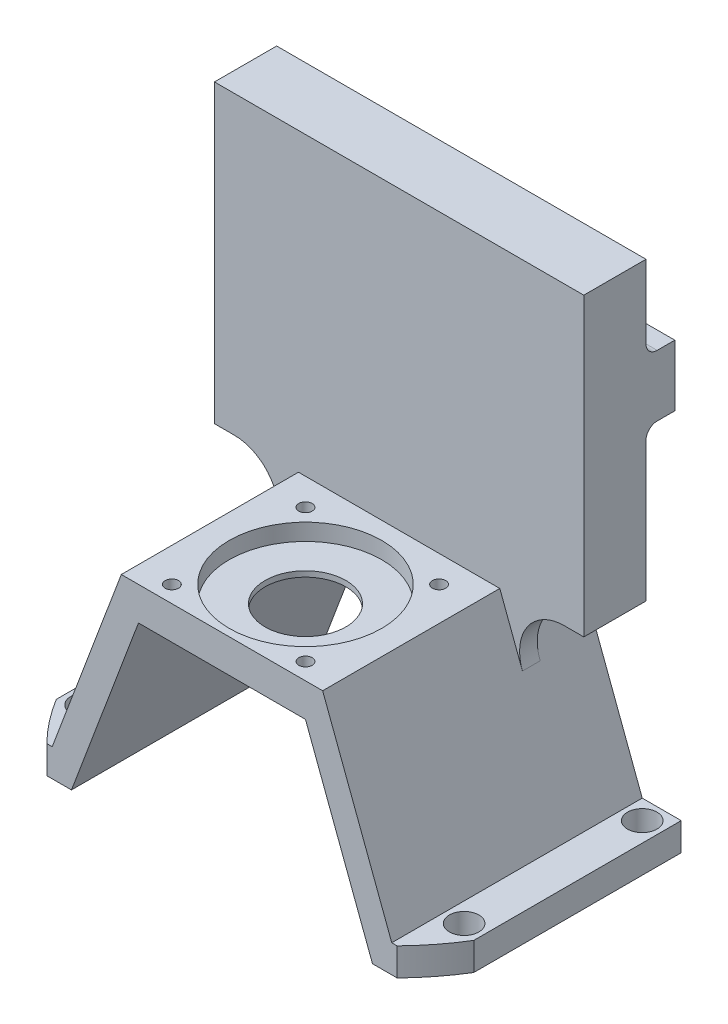
from build123d import *

# Parameters (mm, degrees)
BOSS_EXTRUDE1_DEPTH                             = 45
SKETCH3_R                                       = 13.7
CUT_EXTRUDE1_DEPTH                              = 3
CSK_FOR_M2_FLAT_HEAD_MACHINE_SCREW1_D           = 2.4
CSK_FOR_M2_FLAT_HEAD_MACHINE_SCREW1_CSINK_D     = 4.4
CSK_FOR_M2_FLAT_HEAD_MACHINE_SCREW1_CSINK_ANGLE = 90
SKETCH10_R                                      = 7.25
CUT_EXTRUDE2_DEPTH                              = 69.23672032
SKETCH15_R                                      = 48.495489481
SKETCH15_R_2                                    = 44
CUT_EXTRUDE4_DEPTH                              = 70.822990483
SKETCH11_R                                      = 10.5
CUT_EXTRUDE3_DEPTH                              = 2
CBORE_FOR_M5_HEX_HEAD_BOLT1_D                   = 3.4
CBORE_FOR_M5_HEX_HEAD_BOLT1_CBORE_D             = 5.3
CBORE_FOR_M5_HEX_HEAD_BOLT1_CBORE_DEPTH         = 4
SKETCH19_W                                      = 66.35
SKETCH19_H                                      = 3.175
BOSS_EXTRUDE5_DEPTH                             = 53.175
BOSS_EXTRUDE9_DEPTH                             = 8
FILLET2_R                                       = 8
FILLET3_R                                       = 8
SKETCH24_W                                      = 3.175
SKETCH24_H                                      = 11
BOSS_EXTRUDE10_DEPTH                            = 5.175
SKETCH25_W                                      = 3.175
SKETCH25_H                                      = 11
BOSS_EXTRUDE11_DEPTH                            = 60
FILLET4_R                                       = 2


with BuildPart() as part:
    # Sketch1 → Boss-Extrude1 (new body)
    with BuildSketch(Plane.XY):
        Polygon((-37.5, 0), (-27.038942926, 0), (-15, 32), (15, 32), (27.038942926, 0), (37.5, 0), (37.5, 5), (30.5, 5), (18.084840108, 38), (-18.084840108, 38), (-30.5, 5), (-37.5, 5), align=None)
    extrude(amount=BOSS_EXTRUDE1_DEPTH)

    # Sketch3 → Cut-Extrude1 (cut)
    with BuildSketch(Plane(origin=(0, 38, 0), x_dir=(1, 0, 0), z_dir=(0, 1, 0))):
        with Locations(Location((0, -30, 0), (0, 0, 180))):
            Circle(SKETCH3_R)
    extrude(amount=-CUT_EXTRUDE1_DEPTH, mode=Mode.SUBTRACT)

    # CSK for M2 Flat Head Machine Screw1 (through all)
    with Locations(Plane(origin=(0, 32, 0), x_dir=(-1, 0, 0), z_dir=(0, -1, 0))):
        with Locations((12, -42), (-12, -42), (-12, -18), (12, -18)):
            CounterSinkHole(CSK_FOR_M2_FLAT_HEAD_MACHINE_SCREW1_D / 2, CSK_FOR_M2_FLAT_HEAD_MACHINE_SCREW1_CSINK_D / 2, counter_sink_angle=CSK_FOR_M2_FLAT_HEAD_MACHINE_SCREW1_CSINK_ANGLE)

    # Sketch10 → Cut-Extrude2 (cut, through all)
    with BuildSketch(Plane(origin=(0, 35, 0), x_dir=(1, 0, 0), z_dir=(0, 1, 0))):
        with Locations(Location((0, -30, 0), (0, 0, 180))):
            Circle(SKETCH10_R)
    extrude(amount=-CUT_EXTRUDE2_DEPTH, mode=Mode.SUBTRACT)

    # Sketch15 → Cut-Extrude4 (cut, through all)
    with BuildSketch(Plane(origin=(0, 38, 0), x_dir=(1, 0, 0), z_dir=(0, 1, 0))):
        with Locations((0, -14.25)):
            Circle(SKETCH15_R)
        with Locations((0, -14.25)):
            Circle(SKETCH15_R_2, mode=Mode.SUBTRACT)
    extrude(amount=-CUT_EXTRUDE4_DEPTH, mode=Mode.SUBTRACT)

    # Sketch11 → Cut-Extrude3 (cut)
    with BuildSketch(Plane.XZ.offset(-32)):
        with Locations((0, 30)):
            Circle(SKETCH11_R)
    extrude(amount=-CUT_EXTRUDE3_DEPTH, mode=Mode.SUBTRACT)

    # CBORE for M5 Hex Head Bolt1 (through all)
    with Locations(Plane(origin=(0, 5, 0), x_dir=(-1, 0, 0), z_dir=(0, 1, 0))):
        with Locations((34, 35.5), (34, 3.5), (-34, 3.5), (-34, 35.5)):
            CounterBoreHole(CBORE_FOR_M5_HEX_HEAD_BOLT1_D / 2, CBORE_FOR_M5_HEX_HEAD_BOLT1_CBORE_D / 2, CBORE_FOR_M5_HEX_HEAD_BOLT1_CBORE_DEPTH)

    # Sketch19 → Boss-Extrude5 (add)
    with BuildSketch(Plane(origin=(0, 38, 0), x_dir=(1, 0, 0), z_dir=(0, 1, 0))):
        with Locations((0, -11.5875)):
            Rectangle(SKETCH19_W, SKETCH19_H)
    extrude(amount=BOSS_EXTRUDE5_DEPTH)

    # Sketch23 → Boss-Extrude9 (add)
    with BuildSketch(Plane(origin=(0, 0, 10), x_dir=(-1, 0, 0), z_dir=(0, 0, -1))):
        Polygon((-33.175, 38), (-30, 38), (-30, 88), (33.175, 88), (33.175, 91.175), (-33.175, 91.175), align=None)
    extrude(amount=BOSS_EXTRUDE9_DEPTH)

    # Fillet2
    fillet2_edges = [part.edges().sort_by_distance(p)[0] for p in [
        (18.084840108, 38, 11.5875),
    ]]
    fillet(fillet2_edges, radius=FILLET2_R)

    # Fillet3
    fillet3_edges = [part.edges().sort_by_distance(p)[0] for p in [
        (-18.084840108, 38, 11.5875),
    ]]
    fillet(fillet3_edges, radius=FILLET3_R)

    # Sketch24 → Boss-Extrude10 (add)
    with BuildSketch(Plane(origin=(0, 0, 2), x_dir=(-1, 0, 0), z_dir=(0, 0, -1))):
        with Locations((-31.5875, 70.5)):
            Rectangle(SKETCH24_W, SKETCH24_H)
    extrude(amount=BOSS_EXTRUDE10_DEPTH)

    # Sketch25 → Boss-Extrude11 (add)
    with BuildSketch(Plane.ZY.offset(-30)):
        with Locations((-1.5875, 70.5)):
            Rectangle(SKETCH25_W, SKETCH25_H)
    extrude(amount=BOSS_EXTRUDE11_DEPTH)

    # Fillet4
    fillet4_edges = [part.edges().sort_by_distance(p)[0] for p in [
        (31.5875, 76, 2),
        (31.5875, 65, 2),
    ]]
    fillet(fillet4_edges, radius=FILLET4_R)


solid = part.part
